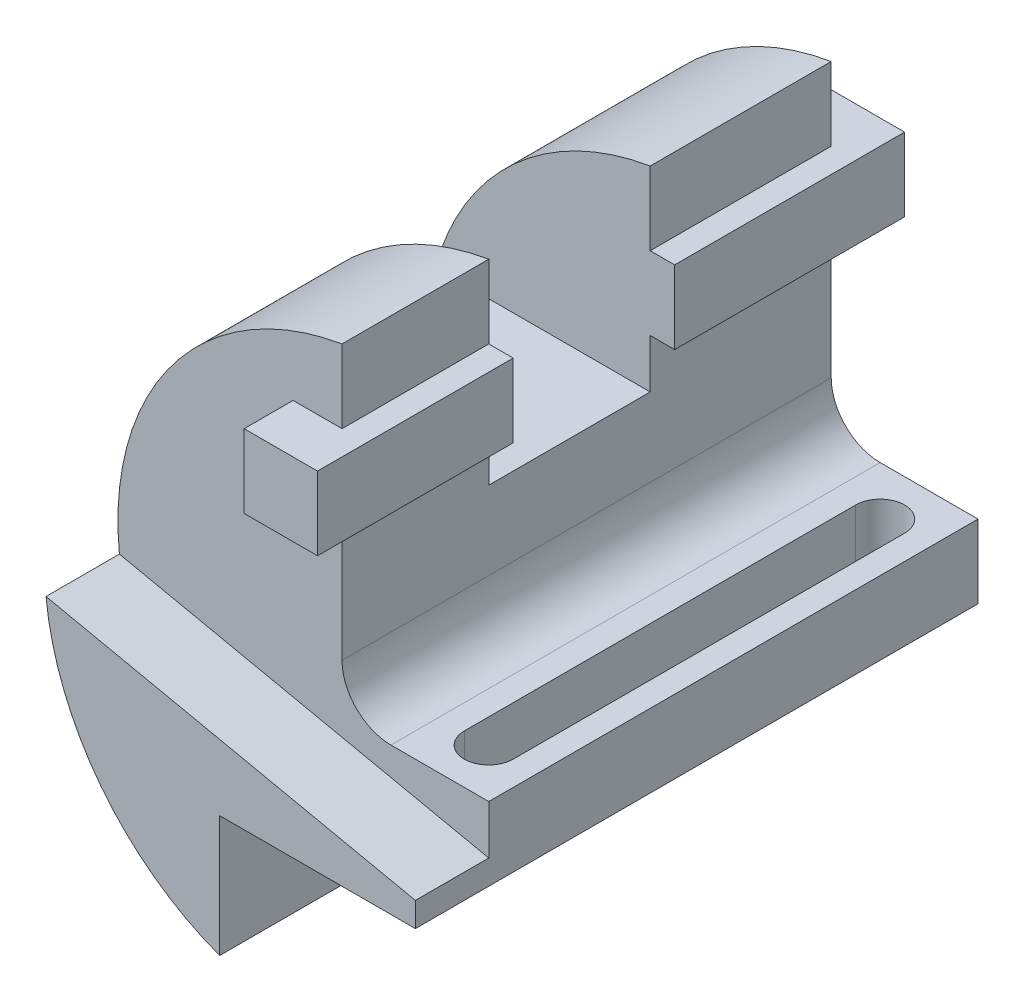
from build123d import *

# Parameters (mm, degrees)
BOSS_EXTRUDE1_DEPTH      = 100
BOSS_EXTRUDE2_START      = 15
BOSS_EXTRUDE2_DEPTH      = 15
CUT_EXTRUDE1_DEPTH       = 15
SKETCH4_W                = 33
SKETCH4_H                = 40
CUT_EXTRUDE2_DEPTH       = 137.596313355
BOSS_EXTRUDE3_DEPTH      = 5
BOSS_EXTRUDE3_DEPTH_BACK = 10
SKETCH5_W                = 47
SKETCH5_H                = 15
BOSS_EXTRUDE4_DEPTH      = 5
BOSS_EXTRUDE4_DEPTH_BACK = 10
SKETCH6_W                = 40
SKETCH6_H                = 15


with BuildPart() as part:
    # Sketch1 → Boss-Extrude1 (new body)
    with BuildSketch(Plane.XY):
        with BuildLine():
            Line((0, 0), (-40, 0))
            Line((-40, 0), (-40, -24.764457872))
            ThreePointArc((-40, -24.764457872), (-75.554844009, 31.952220257), (-30, 81))
            Line((-30, 81), (-30, 25))
            ThreePointArc((-30, 25), (-27.071067812, 17.928932188), (-20, 15))
            Line((-20, 15), (0, 15))
            Line((0, 15), (0, 0))
        make_face()
    extrude(amount=-BOSS_EXTRUDE1_DEPTH)

    # Sketch2 → Boss-Extrude2 (add)
    with BuildSketch(Plane.XY.offset(BOSS_EXTRUDE2_START)):
        with BuildLine():
            Line((0, 0), (0, 5))
            Line((0, 5), (-75.500062866, 21.048033769))
            ThreePointArc((-75.500062866, 21.048033769), (-64.273998003, -6.913628491), (-40, -24.764457872))
            Line((-40, -24.764457872), (-40, 0))
            Line((-40, 0), (0, 0))
        make_face()
    extrude(amount=-BOSS_EXTRUDE2_DEPTH)

    # Sketch3 → Cut-Extrude1 (cut)
    with BuildSketch(Plane(origin=(0, 15, 0), x_dir=(1, 0, 0), z_dir=(0, 1, 0))):
        with BuildLine():
            Line((-5, 90), (-5, 10))
            ThreePointArc((-5, 10), (-10, 5), (-15, 10))
            Line((-15, 10), (-15, 90))
            ThreePointArc((-15, 90), (-10, 95), (-5, 90))
        make_face()
    extrude(amount=-CUT_EXTRUDE1_DEPTH, mode=Mode.SUBTRACT)

    # Sketch4 → Cut-Extrude2 (cut, through all)
    with BuildSketch(Plane(origin=(-30, 0, 0), x_dir=(0, 0, -1), z_dir=(1, 0, 0))):
        with Locations((46.5, 61)):
            Rectangle(SKETCH4_W, SKETCH4_H)
    extrude(amount=-CUT_EXTRUDE2_DEPTH, mode=Mode.SUBTRACT)

    # Sketch5 → Boss-Extrude3 (add, two sides: drawn at the far end of the back side and taken through both)
    with BuildSketch(Plane(origin=(-30, 0, 0), x_dir=(0, 0, -1), z_dir=(1, 0, 0)).offset(-BOSS_EXTRUDE3_DEPTH_BACK)):
        with Locations((86.5, 58.5)):
            Rectangle(SKETCH5_W, SKETCH5_H)
    extrude(amount=BOSS_EXTRUDE3_DEPTH + BOSS_EXTRUDE3_DEPTH_BACK)

    # Sketch6 → Boss-Extrude4 (add, two sides: drawn at the far end of the back side and taken through both)
    with BuildSketch(Plane(origin=(-30, 0, 0), x_dir=(0, 0, -1), z_dir=(1, 0, 0)).offset(-BOSS_EXTRUDE4_DEPTH_BACK)):
        with Locations((10, 58.5)):
            Rectangle(SKETCH6_W, SKETCH6_H)
    extrude(amount=BOSS_EXTRUDE4_DEPTH + BOSS_EXTRUDE4_DEPTH_BACK)


solid = part.part
